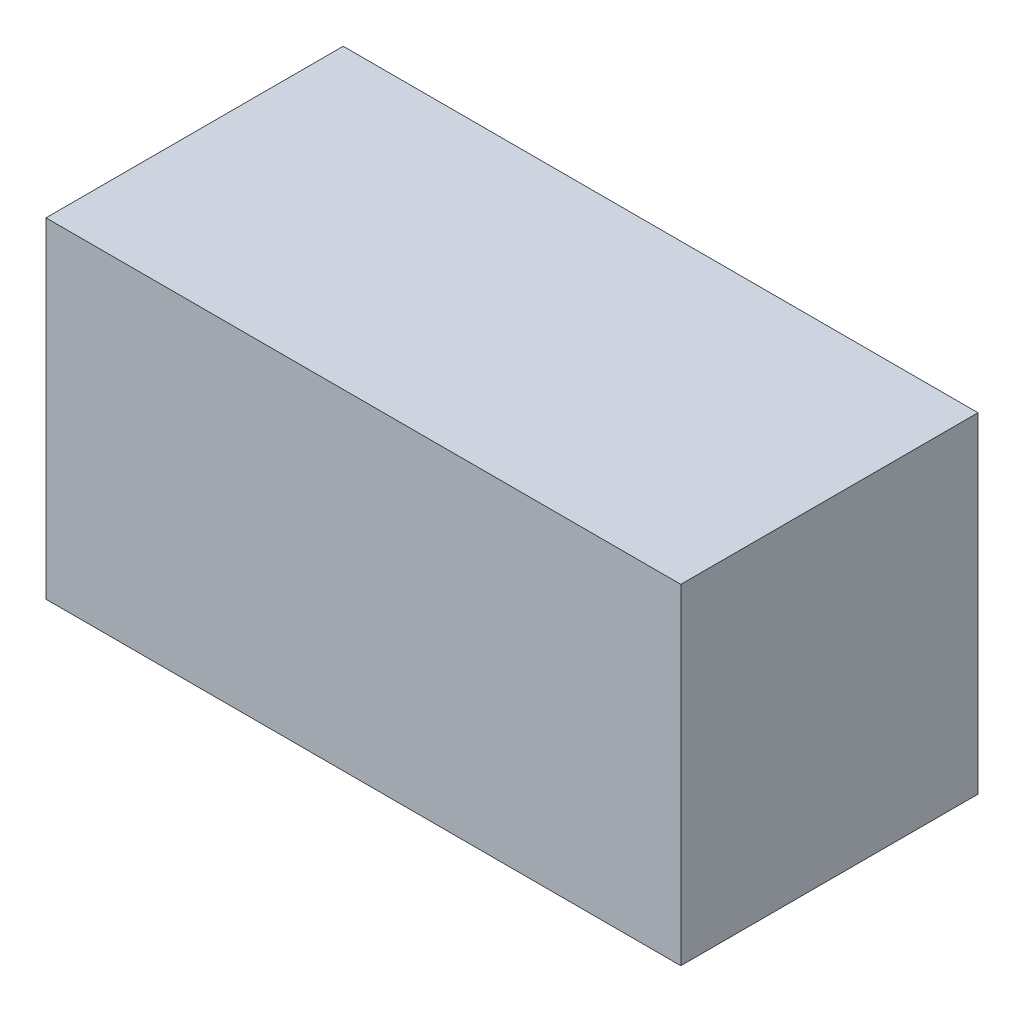
from build123d import *

# Parameters (mm, degrees)
ESBO_O1_W                  = 156.39786889
ESBO_O1_H                  = 127.51
NOVO_DEPTH                 = 40
ESBO_O2_W                  = 24.691065998
ESBO_O2_H                  = 20
RESSALTO_EXTRUS_O2_DEPTH   = 20
RESSALTO_EXTRUS_O2_2_DEPTH = 20
ESBO_O2_W_2                = 42.720162864
ESBO_O2_H_2                = 22.228889681
RESSALTO_EXTRUS_O2_3_DEPTH = 20
RESSALTO_EXTRUS_O2_4_DEPTH = 20


with BuildPart() as part:
    # Esboço1 → Novo (new body)
    with BuildSketch(Plane.XY):
        Rectangle(ESBO_O1_W, ESBO_O1_H)
    extrude(amount=NOVO_DEPTH)


with BuildPart() as body_2:
    # Esboço2 → Ressalto-extrusão2 (new body)
    with BuildSketch(Plane.XY.offset(40)):
        with Locations((-65.853401446, -53.755)):
            Rectangle(ESBO_O2_W, ESBO_O2_H)
    extrude(amount=RESSALTO_EXTRUS_O2_DEPTH)


with BuildPart() as body_3:
    # Esboço2 → Ressalto-extrus_o2 2 (new body)
    with BuildSketch(Plane.XY.offset(40)):
        with Locations((-65.853401446, 53.755)):
            Rectangle(ESBO_O2_W, ESBO_O2_H)
    extrude(amount=RESSALTO_EXTRUS_O2_2_DEPTH)


with BuildPart() as body_4:
    # Esboço2 → Ressalto-extrus_o2 3 (new body)
    with BuildSketch(Plane.XY.offset(40)):
        with Locations((56.838853013, 52.64055516)):
            Rectangle(ESBO_O2_W_2, ESBO_O2_H_2)
    extrude(amount=RESSALTO_EXTRUS_O2_3_DEPTH)


with BuildPart() as body_5:
    # Esboço2 → Ressalto-extrus_o2 4 (new body)
    with BuildSketch(Plane.XY.offset(40)):
        with Locations((56.838853013, -52.64055516)):
            Rectangle(ESBO_O2_W_2, ESBO_O2_H_2)
    extrude(amount=RESSALTO_EXTRUS_O2_4_DEPTH)


solid = body_5.part
